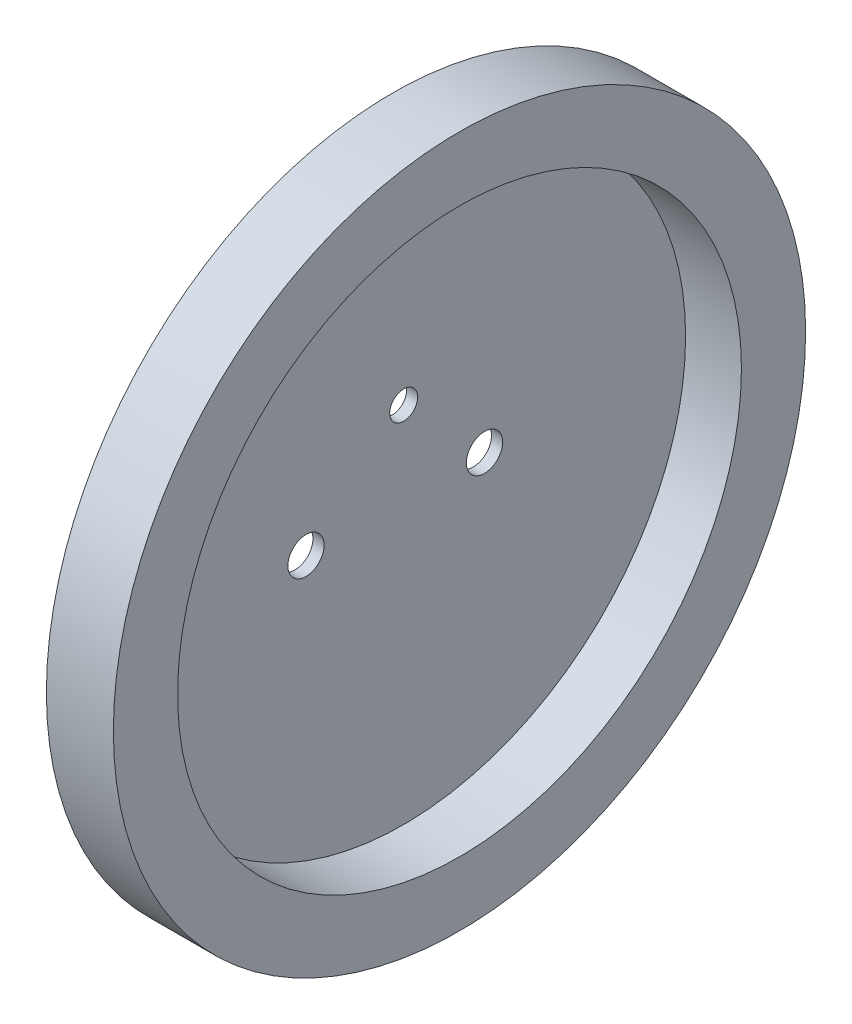
from build123d import *

# Parameters (mm, degrees)
SKETCH2_R           = 62
BOSS_EXTRUDE1_DEPTH = 12
SKETCH4_R           = 50.5
CUT_EXTRUDE2_DEPTH  = 10
SKETCH5_R           = 2.5
SKETCH5_R_2         = 3.25
CUT_EXTRUDE3_DEPTH  = 5


with BuildPart() as part:
    # Sketch2 → Boss-Extrude1 (new body)
    with BuildSketch(Plane(origin=(0, 0, 0), x_dir=(0, 0, -1), z_dir=(1, 0, 0))):
        Circle(SKETCH2_R)
    extrude(amount=BOSS_EXTRUDE1_DEPTH)

    # Sketch4 → Cut-Extrude2 (cut)
    with BuildSketch(Plane(origin=(12, 0, 0), x_dir=(0, 0, -1), z_dir=(1, 0, 0))):
        Circle(SKETCH4_R)
    extrude(amount=-CUT_EXTRUDE2_DEPTH, mode=Mode.SUBTRACT)

    # Sketch5 → Cut-Extrude3 (cut)
    with BuildSketch(Plane.ZY):
        with Locations((0, 14.581539196)):
            Circle(SKETCH5_R)
        with Locations((-14.480976857, 0)):
            Circle(SKETCH5_R_2)
        with Locations((17.497847035, 0)):
            Circle(SKETCH5_R_2)
    extrude(amount=-CUT_EXTRUDE3_DEPTH, mode=Mode.SUBTRACT)


solid = part.part
